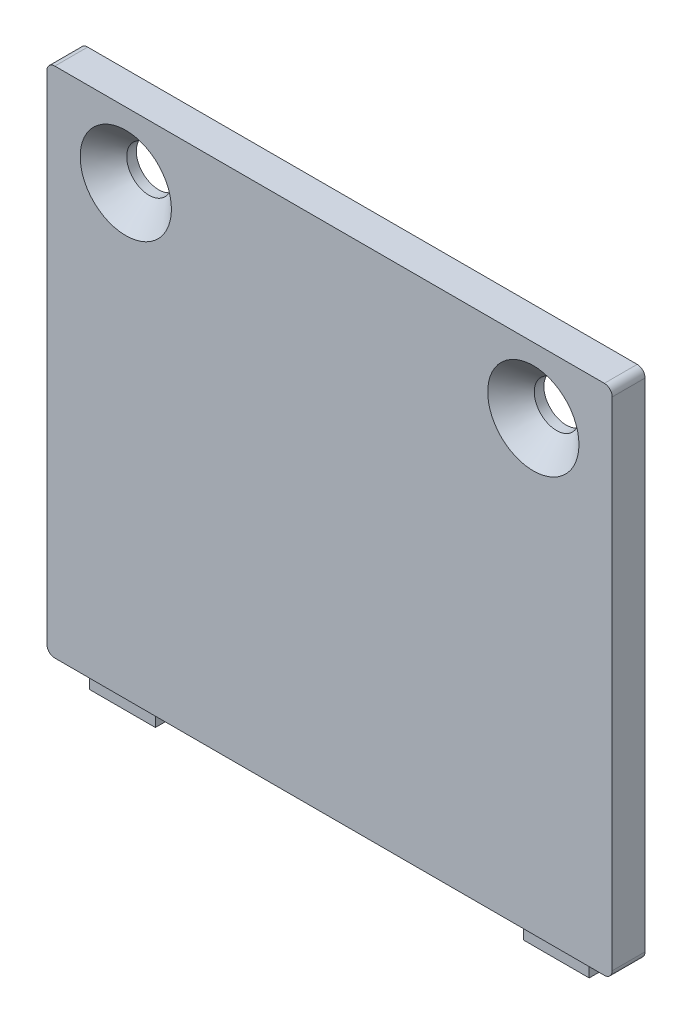
from build123d import *

# Parameters (mm, degrees)
CROQUIS1_W                                           = 43
CROQUIS1_H                                           = 39
SALIENTE_EXTRUIR1_DEPTH                              = 2.5
AVELLANADO_PARA_TORNILLO_CON_CABEZA_AVEL_D           = 3.4
AVELLANADO_PARA_TORNILLO_CON_CABEZA_AVEL_DEPTH       = 12
AVELLANADO_PARA_TORNILLO_CON_CABEZA_AVEL_CSINK_D     = 6.94
AVELLANADO_PARA_TORNILLO_CON_CABEZA_AVEL_CSINK_ANGLE = 90
AVELLANADO_PARA_TORNILLO_CON_CABEZA_AVEL_TIP         = 1.021463052
CROQUIS6_W                                           = 5
CROQUIS6_H                                           = 1
SALIENTE_EXTRUIR2_DEPTH                              = 1.5
REDONDEO1_R                                          = 0.6


with BuildPart() as part:
    # Croquis1 → Saliente-Extruir1 (new body)
    with BuildSketch(Plane.XY):
        Rectangle(CROQUIS1_W, CROQUIS1_H)
    extrude(amount=SALIENTE_EXTRUIR1_DEPTH)

    # Avellanado para tornillo con cabeza avellanada de clavija hexagonal de M31
    with Locations(Plane(origin=(-15.5, 14.5, 2.5), x_dir=(1, 0, 0), z_dir=(0, 0, 1))):
        with Locations((0, 0), (31, 0)):
            CounterSinkHole(AVELLANADO_PARA_TORNILLO_CON_CABEZA_AVEL_D / 2, AVELLANADO_PARA_TORNILLO_CON_CABEZA_AVEL_CSINK_D / 2, depth=AVELLANADO_PARA_TORNILLO_CON_CABEZA_AVEL_DEPTH, counter_sink_angle=AVELLANADO_PARA_TORNILLO_CON_CABEZA_AVEL_CSINK_ANGLE)
            with Locations((0, 0, -(AVELLANADO_PARA_TORNILLO_CON_CABEZA_AVEL_DEPTH + AVELLANADO_PARA_TORNILLO_CON_CABEZA_AVEL_TIP / 2))):  # 118° drill point
                Cone(0, AVELLANADO_PARA_TORNILLO_CON_CABEZA_AVEL_D / 2, AVELLANADO_PARA_TORNILLO_CON_CABEZA_AVEL_TIP, mode=Mode.SUBTRACT)

    # Croquis6 → Saliente-Extruir2 (add)
    with BuildSketch(Plane.XZ.offset(19.5)):
        with Locations((-16.5, 1.25)):
            Rectangle(CROQUIS6_W, CROQUIS6_H)
        with Locations((16.5, 1.25)):
            Rectangle(CROQUIS6_W, CROQUIS6_H)
    extrude(amount=SALIENTE_EXTRUIR2_DEPTH)

    # Redondeo1
    redondeo1_edges = [part.edges().sort_by_distance(p)[0] for p in [
        (21.5, -19.5, 1.25),
        (-21.5, -19.5, 1.25),
        (-21.5, 19.5, 1.25),
        (21.5, 19.5, 1.25),
    ]]
    fillet(redondeo1_edges, radius=REDONDEO1_R)


solid = part.part
